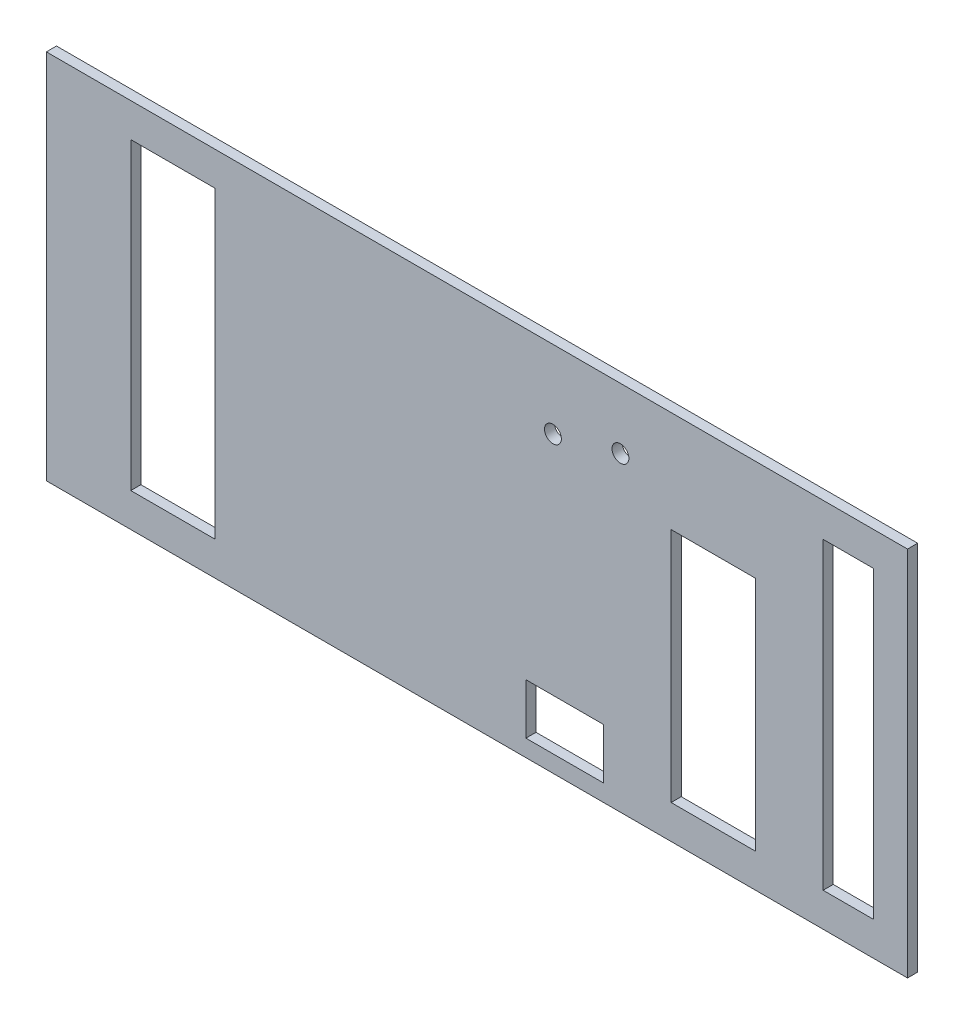
from build123d import *

# Parameters (mm, degrees)
SKETCH1_W           = 255
SKETCH1_H           = 110
SKETCH1_R           = 2.5
SKETCH1_W_2         = 15
SKETCH1_H_2         = 90
SKETCH1_W_3         = 25
SKETCH1_W_4         = 23
SKETCH1_H_3         = 15
SKETCH1_H_4         = 70
BOSS_EXTRUDE1_DEPTH = 3


with BuildPart() as part:
    # Sketch1 → Boss-Extrude1 (new body)
    with BuildSketch(Plane.XY):
        with Locations((6.773927393, -7.260726073)):
            Rectangle(SKETCH1_W, SKETCH1_H)
        with Locations((29.273927393, 24.739273927)):
            Circle(SKETCH1_R, mode=Mode.SUBTRACT)
        with Locations((49.273927393, 29.739273927)):
            Circle(SKETCH1_R, mode=Mode.SUBTRACT)
        with Locations((116.773927393, -7.260726073)):
            Rectangle(SKETCH1_W_2, SKETCH1_H_2, mode=Mode.SUBTRACT)
        with Locations((-83.226072607, -7.260726073)):
            Rectangle(SKETCH1_W_3, SKETCH1_H_2, mode=Mode.SUBTRACT)
        with Locations((32.773927393, -49.760726073)):
            Rectangle(SKETCH1_W_4, SKETCH1_H_3, mode=Mode.SUBTRACT)
        with Locations((76.773927393, -17.260726073)):
            Rectangle(SKETCH1_W_3, SKETCH1_H_4, mode=Mode.SUBTRACT)
    extrude(amount=BOSS_EXTRUDE1_DEPTH)


solid = part.part
